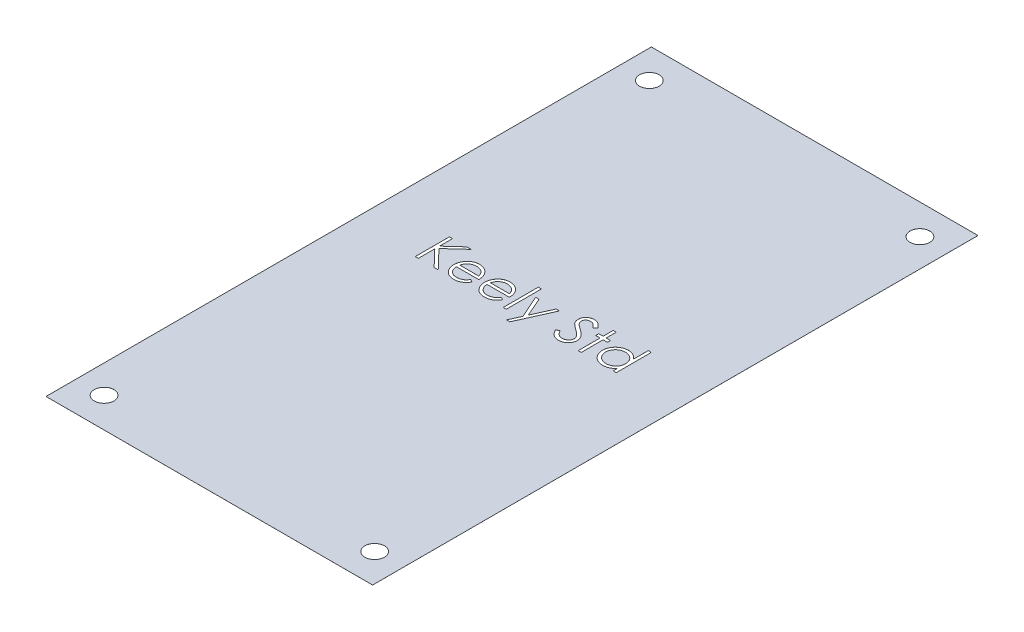
from build123d import *

# Parameters (mm, degrees)
SKETCH2_W           = 60.706
SKETCH2_H           = 112.522
BOSS_EXTRUDE1_DEPTH = 0.00254
SKETCH3_R           = 1.8288
CUT_EXTRUDE1_DEPTH  = 64.926557364
SKETCH5_W           = 0.569871795
SKETCH5_H           = 6.512820513
CUT_EXTRUDE2_DEPTH  = 2.54


with BuildPart() as part:
    # Sketch2 → Boss-Extrude1 (new body)
    with BuildSketch(Plane(origin=(0, 0, 0), x_dir=(1, 0, 0), z_dir=(0, 1, 0))):
        Rectangle(SKETCH2_W, SKETCH2_H)
    extrude(amount=BOSS_EXTRUDE1_DEPTH)

    # Sketch3 → Cut-Extrude1 (cut, through all)
    with BuildSketch(Plane(origin=(0, 0.00254, 0), x_dir=(1, 0, 0), z_dir=(0, 1, 0))):
        with Locations(Location((-25.146, 50.673, 0), (0, 0, 270))):
            Circle(SKETCH3_R)
        with Locations(Location((25.146, 50.673, 0), (0, 0, 270))):
            Circle(SKETCH3_R)
        with Locations(Location((25.146, -50.673, 0), (0, 0, 270))):
            Circle(SKETCH3_R)
        with Locations(Location((-25.146, -50.673, 0), (0, 0, 270))):
            Circle(SKETCH3_R)
    extrude(amount=-CUT_EXTRUDE1_DEPTH, mode=Mode.SUBTRACT)

    # Sketch5 → Cut-Extrude2 (cut)
    # profile 1 of 8: a face of its own
    with BuildSketch(Plane(origin=(0, 0.00254, 0), x_dir=(1, 0, 0), z_dir=(0, 1, 0))):
        Polygon((-18.557291313, 6.920253948), (-17.987419518, 6.920253948), (-17.987419518, 4.502114926), (-15.34031415, 6.920253948), (-14.527483621, 6.920253948), (-17.647786105, 4.070894974), (-14.283252852, 0.570253948), (-15.0426579, 0.570253948), (-17.987419518, 3.634586881), (-17.987419518, 0.570253948), (-18.557291313, 0.570253948), align=None)
    # profile 2 of 8: a face of its own
    with BuildSketch(Plane(origin=(0, 0.00254, 0), x_dir=(1, 0, 0), z_dir=(0, 1, 0))):
        with BuildLine():
            Line((-9.701381858, 2.035638564), (-9.195111826, 1.769783195))
            add(Edge.make_bspline(
                [(-9.195111826, 1.769783195), (-9.235455363, 1.698221722), (-9.31394791, 1.558991436), (-9.448932124, 1.367707918), (-9.590432027, 1.195627062), (-9.74483494, 1.047346118), (-9.907521358, 0.918075748), (-10.07939346, 0.804977123), (-10.261346029, 0.70860495), (-10.453387673, 0.627411078), (-10.657131144, 0.564982425), (-10.873070181, 0.520887624), (-11.101618466, 0.493631122), (-11.258275106, 0.490464938), (-11.338491233, 0.488843692)],
                knots=[0, 0, 0, 0, 1.120438281, 2.179929193, 3.190490725, 4.156257408, 5.095198341, 6.022838206, 6.959905092, 7.901321166, 8.864066838, 9.862729781, 10.905609505, 12, 12, 12, 12], degree=3))
            add(Edge.make_bspline(
                [(-11.338491233, 0.488843692), (-11.427648821, 0.490924996), (-11.601569446, 0.494985016), (-11.854734415, 0.529987059), (-12.093094217, 0.58708691), (-12.31663545, 0.666852964), (-12.52481068, 0.771042537), (-12.71803366, 0.897969026), (-12.897320514, 1.046980402), (-13.057021579, 1.219367378), (-13.200792623, 1.403847501), (-13.327658039, 1.596081748), (-13.433716522, 1.795586455), (-13.519990543, 2.001091549), (-13.589667941, 2.211301756), (-13.638230389, 2.428129704), (-13.66622436, 2.65098855), (-13.67051414, 2.801750859), (-13.672675929, 2.877725903)],
                knots=[0, 0, 0, 0, 1.145258523, 2.234067595, 3.276747158, 4.290159414, 5.277019952, 6.260822364, 7.254936242, 8.264827045, 9.274100331, 10.257902744, 11.220704747, 12.172965371, 13.118907548, 14.062713208, 15.023725156, 16, 16, 16, 16], degree=3))
            add(Edge.make_bspline(
                [(-13.672675929, 2.877725903), (-13.670754344, 2.949017953), (-13.666946016, 3.09030938), (-13.642941587, 3.299434011), (-13.600399684, 3.502685632), (-13.542022639, 3.70023313), (-13.466636807, 3.891745745), (-13.374412638, 4.077340032), (-13.265206467, 4.2568185), (-13.180891759, 4.370035614), (-13.138421121, 4.427064846)],
                knots=[0, 0, 0, 0, 1.024358464, 2.0301432, 3.019427413, 4.004406732, 4.986367066, 5.972626655, 6.978780325, 8, 8, 8, 8], degree=3))
            add(Edge.make_bspline(
                [(-13.138421121, 4.427064846), (-13.080894325, 4.495769796), (-12.967663036, 4.631003297), (-12.776153649, 4.808691402), (-12.568780435, 4.957542252), (-12.348142199, 5.080926627), (-12.111674596, 5.174677387), (-11.862556311, 5.244541143), (-11.597950748, 5.28368982), (-11.41705699, 5.289219461), (-11.324498845, 5.29204882)],
                knots=[0, 0, 0, 0, 1.030682036, 2.02871468, 2.997146059, 3.962720338, 4.930598197, 5.918074684, 6.934738563, 8, 8, 8, 8], degree=3))
            add(Edge.make_bspline(
                [(-11.324498845, 5.29204882), (-11.229343904, 5.289592188), (-11.042671601, 5.284772837), (-10.770470467, 5.240093632), (-10.512913167, 5.169241141), (-10.270102766, 5.069176406), (-10.042014647, 4.940072648), (-9.830131386, 4.780158164), (-9.630829356, 4.594342492), (-9.514880935, 4.451443526), (-9.455879054, 4.378727506)],
                knots=[0, 0, 0, 0, 1.056321875, 2.072262726, 3.055038591, 4.01806755, 4.982017516, 5.957941055, 6.960871419, 8, 8, 8, 8], degree=3))
            add(Edge.make_bspline(
                [(-9.455879054, 4.378727506), (-9.415734465, 4.32392958), (-9.335712504, 4.214698479), (-9.235478479, 4.036587951), (-9.148470063, 3.850241587), (-9.078923119, 3.652647191), (-9.022608596, 3.446145952), (-8.98186551, 3.229261621), (-8.957972059, 3.002058782), (-8.953275423, 2.847252031), (-8.950881057, 2.768330871)],
                knots=[0, 0, 0, 0, 0.94817472, 1.890038105, 2.849395472, 3.817997239, 4.812318967, 5.836947057, 6.897266129, 8, 8, 8, 8], degree=3))
            Line((-8.950881057, 2.768330871), (-13.102804134, 2.768330871))
            add(Edge.make_bspline(
                [(-13.102804134, 2.768330871), (-13.100010848, 2.7071886), (-13.094517964, 2.586954791), (-13.068909061, 2.411022084), (-13.028543429, 2.243430449), (-12.971812415, 2.08543693), (-12.903111138, 1.934977985), (-12.818954195, 1.793169717), (-12.718552433, 1.660658044), (-12.606564378, 1.536257666), (-12.481910077, 1.425476), (-12.350768521, 1.326322063), (-12.211261625, 1.243217623), (-12.064489388, 1.17576268), (-11.910689149, 1.122955507), (-11.749812452, 1.086909603), (-11.582175869, 1.062766709), (-11.467901752, 1.060082174), (-11.409725207, 1.058715487)],
                knots=[0, 0, 0, 0, 1.094153842, 2.151609401, 3.174256925, 4.172055639, 5.149267565, 6.128595816, 7.11444997, 8.118368179, 9.117203808, 10.09244225, 11.054858984, 12.015122123, 12.976791628, 13.957293641, 14.960065497, 16, 16, 16, 16], degree=3))
            add(Edge.make_bspline(
                [(-11.409725207, 1.058715487), (-11.352845268, 1.059818675), (-11.239984557, 1.062007613), (-11.071907573, 1.083292651), (-10.906554431, 1.117710151), (-10.744609504, 1.16468199), (-10.589359541, 1.221971422), (-10.445585471, 1.291100892), (-10.313359937, 1.367572576), (-10.189776298, 1.4550387), (-10.069904639, 1.562096411), (-9.950991842, 1.695692648), (-9.823489914, 1.853694305), (-9.743680224, 1.972612871), (-9.701381858, 2.035638564)],
                knots=[0, 0, 0, 0, 0.99110716, 1.966546729, 2.947904876, 3.932708344, 4.903319531, 5.828989031, 6.710028674, 7.56322171, 8.463672341, 9.504779593, 10.677557249, 12, 12, 12, 12], degree=3))
        make_face()
        with BuildLine():
            add(Edge.make_bspline(
                [(-9.520752852, 3.338202666), (-9.541611013, 3.413791023), (-9.58175626, 3.559274277), (-9.665642236, 3.760734178), (-9.760114888, 3.939782227), (-9.871914315, 4.095048133), (-9.998585432, 4.232940221), (-10.144898834, 4.353442511), (-10.308975384, 4.461242744), (-10.489966968, 4.552233707), (-10.681631349, 4.629685308), (-10.882302583, 4.681619447), (-11.087058856, 4.717196759), (-11.225551061, 4.720509841), (-11.295242034, 4.722177025)],
                knots=[0, 0, 0, 0, 1.154881502, 2.222775134, 3.210006277, 4.132804581, 5.035138423, 5.962687519, 6.919655026, 7.923214229, 8.944639381, 9.960483929, 10.97369054, 12, 12, 12, 12], degree=3))
            add(Edge.make_bspline(
                [(-11.295242034, 4.722177025), (-11.352118873, 4.721067278), (-11.464552425, 4.718873542), (-11.630198648, 4.69806345), (-11.789274673, 4.663664874), (-11.942954267, 4.616557024), (-12.089223556, 4.553767131), (-12.231091207, 4.480137563), (-12.364949926, 4.390254975), (-12.44866342, 4.321749624), (-12.490955175, 4.287140967)],
                knots=[0, 0, 0, 0, 1.04873581, 2.073130211, 3.073294108, 4.04793562, 5.032784715, 6.005352987, 6.992311501, 8, 8, 8, 8], degree=3))
            add(Edge.make_bspline(
                [(-12.490955175, 4.287140967), (-12.521241558, 4.259755566), (-12.582533816, 4.204334188), (-12.664431619, 4.108849771), (-12.742845906, 4.005886222), (-12.81420839, 3.891504353), (-12.87966344, 3.767006654), (-12.940913684, 3.63344323), (-12.996043317, 3.489800551), (-13.027060545, 3.389701983), (-13.043018477, 3.338202666)],
                knots=[0, 0, 0, 0, 0.879870761, 1.780643979, 2.707998968, 3.669668524, 4.684282772, 5.740141944, 6.837334558, 8, 8, 8, 8], degree=3))
            Line((-13.043018477, 3.338202666), (-9.520752852, 3.338202666))
        make_face(mode=Mode.SUBTRACT)
    # profile 3 of 8: a face of its own
    with BuildSketch(Plane(origin=(0, 0.00254, 0), x_dir=(1, 0, 0), z_dir=(0, 1, 0))):
        with BuildLine():
            Line((-4.002663909, 2.035638564), (-3.496393877, 1.769783195))
            add(Edge.make_bspline(
                [(-3.496393877, 1.769783195), (-3.536737414, 1.698221722), (-3.615229961, 1.558991436), (-3.750214175, 1.367707918), (-3.891714078, 1.195627062), (-4.046116992, 1.047346118), (-4.208803409, 0.918075748), (-4.380675511, 0.804977123), (-4.562628081, 0.70860495), (-4.754669724, 0.627411078), (-4.958413196, 0.564982425), (-5.174352233, 0.520887624), (-5.402900517, 0.493631122), (-5.559557158, 0.490464938), (-5.639773284, 0.488843692)],
                knots=[0, 0, 0, 0, 1.120438281, 2.179929193, 3.190490725, 4.156257408, 5.095198341, 6.022838206, 6.959905092, 7.901321166, 8.864066838, 9.862729781, 10.905609505, 12, 12, 12, 12], degree=3))
            add(Edge.make_bspline(
                [(-5.639773284, 0.488843692), (-5.728930872, 0.490924996), (-5.902851497, 0.494985016), (-6.156016467, 0.529987059), (-6.394376269, 0.58708691), (-6.617917502, 0.666852964), (-6.826092731, 0.771042537), (-7.019315711, 0.897969026), (-7.198602565, 1.046980402), (-7.35830363, 1.219367378), (-7.502074675, 1.403847501), (-7.628940091, 1.596081748), (-7.734998573, 1.795586455), (-7.821272594, 2.001091549), (-7.890949992, 2.211301756), (-7.93951244, 2.428129704), (-7.967506412, 2.65098855), (-7.971796191, 2.801750859), (-7.97395798, 2.877725903)],
                knots=[0, 0, 0, 0, 1.145258523, 2.234067595, 3.276747158, 4.290159414, 5.277019952, 6.260822364, 7.254936242, 8.264827045, 9.274100331, 10.257902744, 11.220704747, 12.172965371, 13.118907548, 14.062713208, 15.023725156, 16, 16, 16, 16], degree=3))
            add(Edge.make_bspline(
                [(-7.97395798, 2.877725903), (-7.972036395, 2.949017953), (-7.968228067, 3.09030938), (-7.944223639, 3.299434011), (-7.901681735, 3.502685632), (-7.843304691, 3.70023313), (-7.767918858, 3.891745745), (-7.675694689, 4.077340032), (-7.566488518, 4.2568185), (-7.48217381, 4.370035614), (-7.439703172, 4.427064846)],
                knots=[0, 0, 0, 0, 1.024358464, 2.0301432, 3.019427413, 4.004406732, 4.986367066, 5.972626655, 6.978780325, 8, 8, 8, 8], degree=3))
            add(Edge.make_bspline(
                [(-7.439703172, 4.427064846), (-7.382176376, 4.495769796), (-7.268945087, 4.631003297), (-7.0774357, 4.808691402), (-6.870062486, 4.957542252), (-6.649424251, 5.080926627), (-6.412956648, 5.174677387), (-6.163838362, 5.244541143), (-5.899232799, 5.28368982), (-5.718339041, 5.289219461), (-5.625780896, 5.29204882)],
                knots=[0, 0, 0, 0, 1.030682036, 2.02871468, 2.997146059, 3.962720338, 4.930598197, 5.918074684, 6.934738563, 8, 8, 8, 8], degree=3))
            add(Edge.make_bspline(
                [(-5.625780896, 5.29204882), (-5.530625955, 5.289592188), (-5.343953652, 5.284772837), (-5.071752518, 5.240093632), (-4.814195218, 5.169241141), (-4.571384818, 5.069176406), (-4.343296699, 4.940072648), (-4.131413437, 4.780158164), (-3.932111407, 4.594342492), (-3.816162986, 4.451443526), (-3.757161105, 4.378727506)],
                knots=[0, 0, 0, 0, 1.056321875, 2.072262726, 3.055038591, 4.01806755, 4.982017516, 5.957941055, 6.960871419, 8, 8, 8, 8], degree=3))
            add(Edge.make_bspline(
                [(-3.757161105, 4.378727506), (-3.717016517, 4.32392958), (-3.636994555, 4.214698479), (-3.536760531, 4.036587951), (-3.449752114, 3.850241587), (-3.38020517, 3.652647191), (-3.323890647, 3.446145952), (-3.283147561, 3.229261621), (-3.259254111, 3.002058782), (-3.254557474, 2.847252031), (-3.252163108, 2.768330871)],
                knots=[0, 0, 0, 0, 0.94817472, 1.890038105, 2.849395472, 3.817997239, 4.812318967, 5.836947057, 6.897266129, 8, 8, 8, 8], degree=3))
            Line((-3.252163108, 2.768330871), (-7.404086185, 2.768330871))
            add(Edge.make_bspline(
                [(-7.404086185, 2.768330871), (-7.401292899, 2.7071886), (-7.395800015, 2.586954791), (-7.370191112, 2.411022084), (-7.32982548, 2.243430449), (-7.273094466, 2.08543693), (-7.20439319, 1.934977985), (-7.120236246, 1.793169717), (-7.019834484, 1.660658044), (-6.90784643, 1.536257666), (-6.783192128, 1.425476), (-6.652050572, 1.326322063), (-6.512543676, 1.243217623), (-6.365771439, 1.17576268), (-6.2119712, 1.122955507), (-6.051094503, 1.086909603), (-5.883457921, 1.062766709), (-5.769183803, 1.060082174), (-5.711007259, 1.058715487)],
                knots=[0, 0, 0, 0, 1.094153842, 2.151609401, 3.174256925, 4.172055639, 5.149267565, 6.128595816, 7.11444997, 8.118368179, 9.117203808, 10.09244225, 11.054858984, 12.015122123, 12.976791628, 13.957293641, 14.960065497, 16, 16, 16, 16], degree=3))
            add(Edge.make_bspline(
                [(-5.711007259, 1.058715487), (-5.654127319, 1.059818675), (-5.541266609, 1.062007613), (-5.373189625, 1.083292651), (-5.207836482, 1.117710151), (-5.045891555, 1.16468199), (-4.890641592, 1.221971422), (-4.746867523, 1.291100892), (-4.614641989, 1.367572576), (-4.491058349, 1.4550387), (-4.37118669, 1.562096411), (-4.252273893, 1.695692648), (-4.124771965, 1.853694305), (-4.044962275, 1.972612871), (-4.002663909, 2.035638564)],
                knots=[0, 0, 0, 0, 0.99110716, 1.966546729, 2.947904876, 3.932708344, 4.903319531, 5.828989031, 6.710028674, 7.56322171, 8.463672341, 9.504779593, 10.677557249, 12, 12, 12, 12], degree=3))
        make_face()
        with BuildLine():
            add(Edge.make_bspline(
                [(-3.822034903, 3.338202666), (-3.842893065, 3.413791023), (-3.883038312, 3.559274277), (-3.966924287, 3.760734178), (-4.061396939, 3.939782227), (-4.173196366, 4.095048133), (-4.299867483, 4.232940221), (-4.446180886, 4.353442511), (-4.610257435, 4.461242744), (-4.791249019, 4.552233707), (-4.982913401, 4.629685308), (-5.183584635, 4.681619447), (-5.388340907, 4.717196759), (-5.526833112, 4.720509841), (-5.596524086, 4.722177025)],
                knots=[0, 0, 0, 0, 1.154881502, 2.222775134, 3.210006277, 4.132804581, 5.035138423, 5.962687519, 6.919655026, 7.923214229, 8.944639381, 9.960483929, 10.97369054, 12, 12, 12, 12], degree=3))
            add(Edge.make_bspline(
                [(-5.596524086, 4.722177025), (-5.653400924, 4.721067278), (-5.765834476, 4.718873542), (-5.9314807, 4.69806345), (-6.090556725, 4.663664874), (-6.244236318, 4.616557024), (-6.390505608, 4.553767131), (-6.532373259, 4.480137563), (-6.666231978, 4.390254975), (-6.749945471, 4.321749624), (-6.792237227, 4.287140967)],
                knots=[0, 0, 0, 0, 1.04873581, 2.073130211, 3.073294108, 4.04793562, 5.032784715, 6.005352987, 6.992311501, 8, 8, 8, 8], degree=3))
            add(Edge.make_bspline(
                [(-6.792237227, 4.287140967), (-6.82252361, 4.259755566), (-6.883815867, 4.204334188), (-6.965713671, 4.108849771), (-7.044127957, 4.005886222), (-7.115490441, 3.891504353), (-7.180945491, 3.767006654), (-7.242195735, 3.63344323), (-7.297325368, 3.489800551), (-7.328342597, 3.389701983), (-7.344300528, 3.338202666)],
                knots=[0, 0, 0, 0, 0.879870761, 1.780643979, 2.707998968, 3.669668524, 4.684282772, 5.740141944, 6.837334558, 8, 8, 8, 8], degree=3))
            Line((-7.344300528, 3.338202666), (-3.822034903, 3.338202666))
        make_face(mode=Mode.SUBTRACT)
    # profile 4 of 8: a face of its own
    with BuildSketch(Plane(origin=(0, 0.00254, 0), x_dir=(1, 0, 0), z_dir=(0, 1, 0))):
        with Locations((-1.908893878, 3.826664205)):
            Rectangle(SKETCH5_W, SKETCH5_H)
    # profile 5 of 8: a face of its own
    with BuildSketch(Plane(origin=(0, 0.00254, 0), x_dir=(1, 0, 0), z_dir=(0, 1, 0))):
        Polygon((-0.809855416, 5.210638564), (-0.195462387, 5.210638564), (1.375501155, 1.656572057), (2.970633366, 5.210638564), (3.58629843, 5.210638564), (0.736939456, -1.139361436), (0.121274392, -1.139361436), (1.066396588, 0.965856913), align=None)
    # profile 6 of 8: a face of its own
    with BuildSketch(Plane(origin=(0, 0.00254, 0), x_dir=(1, 0, 0), z_dir=(0, 1, 0))):
        with BuildLine():
            Line((6.272836892, 1.7952239), (6.80963577, 2.11704882))
            add(Edge.make_bspline(
                [(6.80963577, 2.11704882), (6.859561715, 2.033474864), (6.955217898, 1.873350391), (7.114786793, 1.656982232), (7.280127932, 1.473082319), (7.452465723, 1.322720474), (7.630748228, 1.20434035), (7.816139297, 1.120516302), (8.008014182, 1.068235889), (8.138595259, 1.061885732), (8.203786411, 1.058715487)],
                knots=[0, 0, 0, 0, 1.272034388, 2.437168799, 3.508375237, 4.49857839, 5.41946034, 6.295179144, 7.148887113, 8, 8, 8, 8], degree=3))
            add(Edge.make_bspline(
                [(8.203786411, 1.058715487), (8.259461144, 1.060266107), (8.369836432, 1.063340215), (8.53232793, 1.092878241), (8.690137771, 1.13825739), (8.840013443, 1.203246794), (8.979886915, 1.281875189), (9.102544776, 1.376846111), (9.208582724, 1.483174513), (9.295322118, 1.601797329), (9.361870182, 1.729372728), (9.413018649, 1.860320525), (9.441403283, 1.996697785), (9.445679107, 2.088519624), (9.447836892, 2.134857314)],
                knots=[0, 0, 0, 0, 1.095163259, 2.171163733, 3.241058638, 4.321873601, 5.38011039, 6.391990106, 7.366004449, 8.327778327, 9.272591725, 10.192022065, 11.087607919, 12, 12, 12, 12], degree=3))
            add(Edge.make_bspline(
                [(9.447836892, 2.134857314), (9.445162071, 2.187727141), (9.439724551, 2.295203774), (9.393766009, 2.453771716), (9.32146809, 2.61069395), (9.25477015, 2.707760532), (9.220142581, 2.758154589)],
                knots=[0, 0, 0, 0, 0.938893495, 1.908633276, 2.914225137, 4, 4, 4, 4], degree=3))
            add(Edge.make_bspline(
                [(9.220142581, 2.758154589), (9.19171161, 2.794525255), (9.132024341, 2.870880918), (9.029412854, 2.984537274), (8.909005761, 3.101773548), (8.774923597, 3.227066409), (8.622282136, 3.354588554), (8.455862217, 3.490421001), (8.27141493, 3.629398148), (8.142057272, 3.72260266), (8.07531085, 3.770694653)],
                knots=[0, 0, 0, 0, 0.722233717, 1.516239348, 2.393582979, 3.351407094, 4.387010283, 5.505090956, 6.712668013, 8, 8, 8, 8], degree=3))
            add(Edge.make_bspline(
                [(8.07531085, 3.770694653), (8.0085016, 3.818280805), (7.880767401, 3.909261904), (7.702135402, 4.044288819), (7.54239759, 4.167739839), (7.402263946, 4.280777119), (7.281796106, 4.383415987), (7.180044775, 4.47467082), (7.099601964, 4.557009566), (7.054869696, 4.610424571), (7.034786011, 4.634406592)],
                knots=[0, 0, 0, 0, 1.452282411, 2.77665338, 3.964542531, 5.026858415, 5.96415736, 6.766646006, 7.446254459, 8, 8, 8, 8], degree=3))
            add(Edge.make_bspline(
                [(7.034786011, 4.634406592), (7.006714393, 4.671782759), (6.951507789, 4.745288008), (6.878635179, 4.860177392), (6.816696984, 4.977785317), (6.768142467, 5.098427814), (6.727255327, 5.220411185), (6.69975451, 5.345327016), (6.682534404, 5.472614796), (6.680770943, 5.558273575), (6.679888174, 5.601153387)],
                knots=[0, 0, 0, 0, 1.068054152, 2.10047183, 3.106115577, 4.101338837, 5.06977816, 6.043150881, 7.020423561, 8, 8, 8, 8], degree=3))
            add(Edge.make_bspline(
                [(6.679888174, 5.601153387), (6.682256196, 5.668335978), (6.686941625, 5.80126518), (6.726566564, 5.995449686), (6.789110242, 6.180845043), (6.876730967, 6.355615792), (6.989683593, 6.515211214), (7.120395575, 6.661467112), (7.276082129, 6.784418682), (7.446901888, 6.891846274), (7.633875592, 6.975931024), (7.829801945, 7.039360231), (8.034992347, 7.075299884), (8.17397232, 7.080457472), (8.244491539, 7.083074461)],
                knots=[0, 0, 0, 0, 1.005424448, 1.989358655, 2.955360095, 3.929531133, 4.905563448, 5.876582895, 6.856512386, 7.866279853, 8.892233794, 9.918561126, 10.94386622, 12, 12, 12, 12], degree=3))
            add(Edge.make_bspline(
                [(8.244491539, 7.083074461), (8.319320121, 7.080493546), (8.468130288, 7.07536093), (8.687022436, 7.03073398), (8.897771165, 6.956891333), (9.067303945, 6.87309191), (9.19998767, 6.789396342), (9.301175342, 6.713160375), (9.403714145, 6.625394106), (9.508431188, 6.52586376), (9.613552098, 6.413656083), (9.720637505, 6.289539547), (9.829937821, 6.154272653), (9.900252024, 6.057708202), (9.93629843, 6.008204669)],
                knots=[0, 0, 0, 0, 1.286793592, 2.559021753, 3.825965368, 5.121522368, 5.803751409, 6.523245864, 7.299691795, 8.125521123, 9.008227632, 9.944561021, 10.946284179, 12, 12, 12, 12], degree=3))
            Line((9.93629843, 6.008204669), (9.421124152, 5.617689846))
            add(Edge.make_bspline(
                [(9.421124152, 5.617689846), (9.390016531, 5.657765041), (9.330110528, 5.734940498), (9.239161316, 5.843019885), (9.153438769, 5.941746926), (9.068983044, 6.027499373), (8.990254598, 6.104973243), (8.91384225, 6.171303088), (8.840845641, 6.227138811), (8.748830675, 6.286726412), (8.633228529, 6.345793212), (8.488113727, 6.39577511), (8.336464342, 6.425810723), (8.233177725, 6.42978199), (8.180889777, 6.43179241)],
                knots=[0, 0, 0, 0, 1.181633172, 2.275549214, 3.290209073, 4.226197932, 5.078386478, 5.862611352, 6.581680152, 7.217281963, 8.414376989, 9.595101626, 10.782541182, 12, 12, 12, 12], degree=3))
            add(Edge.make_bspline(
                [(8.180889777, 6.43179241), (8.115291515, 6.42959404), (7.988791446, 6.42535469), (7.809194874, 6.379054146), (7.647553039, 6.306152771), (7.508664814, 6.20398131), (7.393027727, 6.082930366), (7.309379252, 5.943631587), (7.259032525, 5.789812085), (7.252888846, 5.682512222), (7.249759969, 5.627866128)],
                knots=[0, 0, 0, 0, 1.14458467, 2.207223713, 3.21896685, 4.227309161, 5.202851033, 6.127160689, 7.046193047, 8, 8, 8, 8], degree=3))
            add(Edge.make_bspline(
                [(7.249759969, 5.627866128), (7.250473213, 5.593845588), (7.251900867, 5.525748878), (7.271812286, 5.425144156), (7.297392497, 5.324793583), (7.337928415, 5.225148325), (7.393890608, 5.124465703), (7.46737857, 5.021011979), (7.559931294, 4.913875307), (7.630828159, 4.844193358), (7.668259568, 4.807403387)],
                knots=[0, 0, 0, 0, 0.858281714, 1.717966888, 2.583508476, 3.4729293, 4.427298488, 5.488583878, 6.674047936, 8, 8, 8, 8], degree=3))
            add(Edge.make_bspline(
                [(7.668259568, 4.807403387), (7.682159487, 4.794999069), (7.715182511, 4.765529248), (7.775554548, 4.717283253), (7.855279339, 4.657769652), (7.952275047, 4.584132664), (8.068330118, 4.49871344), (8.203457312, 4.402604172), (8.356150379, 4.292684839), (8.464502998, 4.215836158), (8.521795225, 4.175201865)],
                knots=[0, 0, 0, 0, 0.420754252, 0.999615792, 1.744751191, 2.668019286, 3.750313428, 4.999500688, 6.413464383, 8, 8, 8, 8], degree=3))
            add(Edge.make_bspline(
                [(8.521795225, 4.175201865), (8.590712525, 4.125052541), (8.724161325, 4.027945326), (8.914040077, 3.882048307), (9.086204557, 3.739358784), (9.241259226, 3.600787982), (9.380735903, 3.467387014), (9.503087196, 3.337550958), (9.609559788, 3.21220999), (9.724184941, 3.051514031), (9.841311271, 2.854154064), (9.941898006, 2.61234926), (10.005322436, 2.369604507), (10.013616472, 2.206451532), (10.017708687, 2.125953067)],
                knots=[0, 0, 0, 0, 1.163667725, 2.253281268, 3.268753668, 4.215851969, 5.092017293, 5.902905408, 6.650798638, 7.335211899, 8.59617414, 9.77448103, 10.901945474, 12, 12, 12, 12], degree=3))
            add(Edge.make_bspline(
                [(10.017708687, 2.125953067), (10.016516451, 2.069023747), (10.01415513, 1.956270637), (9.987011758, 1.790707855), (9.947243223, 1.629906134), (9.887304241, 1.475853116), (9.814146511, 1.325730475), (9.721316319, 1.183476141), (9.613715234, 1.045941675), (9.490282546, 0.916794484), (9.355216409, 0.798237814), (9.212461706, 0.692775088), (9.061784782, 0.604839701), (8.904003036, 0.533083174), (8.739080225, 0.476960935), (8.567071817, 0.436297586), (8.387694275, 0.411340797), (8.265773402, 0.408750429), (8.203786411, 0.407433435)],
                knots=[0, 0, 0, 0, 0.983748083, 1.948392443, 2.894712957, 3.844097841, 4.80183111, 5.778335162, 6.776009319, 7.81870978, 8.863265674, 9.881300176, 10.883814829, 11.87499822, 12.874611388, 13.892143829, 14.928324115, 16, 16, 16, 16], degree=3))
            add(Edge.make_bspline(
                [(8.203786411, 0.407433435), (8.155825146, 0.408360865), (8.060506639, 0.410204044), (7.919519436, 0.426498652), (7.781380467, 0.449552969), (7.647823127, 0.486154496), (7.51712668, 0.530562726), (7.389859554, 0.585242272), (7.265960071, 0.650769195), (7.144733885, 0.725690168), (7.026489311, 0.812880647), (6.912335419, 0.914432562), (6.798526754, 1.027545121), (6.688422478, 1.155290001), (6.579795487, 1.295603379), (6.474787516, 1.449798041), (6.371224971, 1.617034097), (6.306245479, 1.734717895), (6.272836892, 1.7952239)],
                knots=[0, 0, 0, 0, 0.915332311, 1.819136955, 2.706846663, 3.586547465, 4.459518054, 5.340707479, 6.227863349, 7.133153174, 8.059268498, 9.028702269, 10.047606654, 11.120612155, 12.245963614, 13.433783089, 14.680604001, 16, 16, 16, 16], degree=3))
        make_face()
    # profile 7 of 8: a face of its own
    with BuildSketch(Plane(origin=(0, 0.00254, 0), x_dir=(1, 0, 0), z_dir=(0, 1, 0))):
        Polygon((11.727324071, 7.083074461), (12.297195866, 7.083074461), (12.297195866, 5.210638564), (13.11129843, 5.210638564), (13.11129843, 4.640766769), (12.297195866, 4.640766769), (12.297195866, 0.570253948), (11.727324071, 0.570253948), (11.727324071, 4.640766769), (10.913221507, 4.640766769), (10.913221507, 5.210638564), (11.727324071, 5.210638564), align=None)
    # profile 8 of 8: a face of its own
    with BuildSketch(Plane(origin=(0, 0.00254, 0), x_dir=(1, 0, 0), z_dir=(0, 1, 0))):
        with BuildLine():
            Line((18.810016379, 7.083074461), (18.810016379, 0.570253948))
            Line((18.810016379, 0.570253948), (18.240144584, 0.570253948))
            Line((18.240144584, 0.570253948), (18.240144584, 1.372908195))
            add(Edge.make_bspline(
                [(18.240144584, 1.372908195), (18.175884778, 1.300264932), (18.050480959, 1.15850069), (17.841037788, 0.973294463), (17.619026951, 0.820208079), (17.385525983, 0.696564661), (17.140745741, 0.603687644), (16.88522884, 0.537672756), (16.618871049, 0.495229655), (16.436984634, 0.490991443), (16.344812052, 0.488843692)],
                knots=[0, 0, 0, 0, 1.074387032, 2.096679803, 3.090159297, 4.057316773, 5.018401886, 5.985159533, 6.978961417, 8, 8, 8, 8], degree=3))
            add(Edge.make_bspline(
                [(16.344812052, 0.488843692), (16.262864479, 0.491068681), (16.101260236, 0.49545646), (15.863536053, 0.529496639), (15.634768686, 0.584162195), (15.414741961, 0.660182381), (15.20487964, 0.761021871), (15.003384894, 0.881746707), (14.811301581, 1.025512213), (14.631557503, 1.189864779), (14.466036588, 1.368381398), (14.320782565, 1.558782605), (14.199673406, 1.760245071), (14.098399831, 1.970218078), (14.020392177, 2.190318004), (13.966011441, 2.419783723), (13.932010916, 2.658343922), (13.927624952, 2.820794199), (13.925400995, 2.903166608)],
                knots=[0, 0, 0, 0, 1.033919861, 2.038935746, 3.024066025, 3.998881131, 4.97069526, 5.957263378, 6.95902576, 7.993208707, 9.027059324, 10.027763471, 11.009749337, 11.988697705, 12.965288445, 13.950418724, 14.960734635, 16, 16, 16, 16], degree=3))
            add(Edge.make_bspline(
                [(13.925400995, 2.903166608), (13.927674243, 2.983836471), (13.932168331, 3.143316436), (13.965647745, 3.377864931), (14.02194686, 3.603776633), (14.100955098, 3.82032423), (14.202268359, 4.027769749), (14.325509317, 4.226259909), (14.470686872, 4.41634153), (14.638059096, 4.593545042), (14.819369322, 4.757231013), (15.013332305, 4.899487424), (15.215123116, 5.022345136), (15.427871721, 5.119687871), (15.648429182, 5.19844439), (15.878759005, 5.252932775), (16.117902869, 5.285040772), (16.280264191, 5.289690358), (16.362620546, 5.29204882)],
                knots=[0, 0, 0, 0, 1.020392517, 2.01726096, 2.990465484, 3.961182959, 4.928053699, 5.906110375, 6.912531644, 7.948652711, 8.985773172, 9.998621852, 10.987621588, 11.969261332, 12.953316658, 13.946091881, 14.958173133, 16, 16, 16, 16], degree=3))
            add(Edge.make_bspline(
                [(16.362620546, 5.29204882), (16.457356754, 5.28920566), (16.643313403, 5.283624853), (16.915272149, 5.236986159), (17.172515385, 5.158676366), (17.416524091, 5.051467898), (17.645843565, 4.912129393), (17.862154756, 4.743851766), (18.061695927, 4.541872515), (18.179754805, 4.390177232), (18.240144584, 4.312581673)],
                knots=[0, 0, 0, 0, 1.031072012, 2.023879775, 2.993683497, 3.952812103, 4.918022106, 5.908088563, 6.929940113, 8, 8, 8, 8], degree=3))
            Line((18.240144584, 4.312581673), (18.240144584, 7.083074461))
            Line((18.240144584, 7.083074461), (18.810016379, 7.083074461))
        make_face()
        with BuildLine():
            add(Edge.make_bspline(
                [(16.370252757, 4.722177025), (16.28695103, 4.719213139), (16.12252667, 4.713362901), (15.881146838, 4.667690988), (15.650163929, 4.591700367), (15.430733195, 4.487774632), (15.226320859, 4.357093924), (15.04363377, 4.199030843), (14.881177726, 4.017897974), (14.744547018, 3.814512717), (14.633167117, 3.596475323), (14.554849788, 3.3685567), (14.503198439, 3.134867669), (14.497921551, 2.976366796), (14.495272789, 2.896806432)],
                knots=[0, 0, 0, 0, 1.031046209, 2.035121221, 3.029706178, 4.034933723, 5.034054252, 6.02443088, 7.017295772, 8.038157696, 9.050218397, 10.03989886, 11.016116709, 12, 12, 12, 12], degree=3))
            add(Edge.make_bspline(
                [(14.495272789, 2.896806432), (14.498656239, 2.817721523), (14.505409875, 2.659861692), (14.553943278, 2.425854074), (14.635368191, 2.197881741), (14.746478791, 1.977879652), (14.885610238, 1.773619928), (15.046879651, 1.589034277), (15.23184659, 1.430303166), (15.436729353, 1.297429283), (15.65554667, 1.190091566), (15.88565966, 1.115405335), (16.122742604, 1.067185647), (16.283946124, 1.061553239), (16.365164616, 1.058715487)],
                knots=[0, 0, 0, 0, 0.979072187, 1.954306742, 2.945804271, 3.96968567, 4.997920485, 5.998718438, 6.996577872, 8.005894225, 9.015743152, 10.005417472, 10.995077863, 12, 12, 12, 12], degree=3))
            add(Edge.make_bspline(
                [(16.365164616, 1.058715487), (16.447617557, 1.061727135), (16.611608278, 1.067717006), (16.85370422, 1.113584445), (17.088645081, 1.189364979), (17.313230481, 1.294410537), (17.52244689, 1.424598883), (17.710221611, 1.577011748), (17.869000582, 1.754273239), (18.003607174, 1.949084804), (18.109154001, 2.162647998), (18.18603628, 2.39004003), (18.231491224, 2.631268816), (18.237220247, 2.79612194), (18.240144584, 2.880269974)],
                knots=[0, 0, 0, 0, 1.01762866, 2.023962475, 3.030623092, 4.058876274, 5.077231937, 6.066672613, 7.034107872, 8.005628644, 8.981990164, 9.965428785, 10.961468474, 12, 12, 12, 12], degree=3))
            add(Edge.make_bspline(
                [(18.240144584, 2.880269974), (18.238403493, 2.944382895), (18.234976476, 3.070577413), (18.2087953, 3.255865909), (18.167148504, 3.433182812), (18.10846331, 3.602714547), (18.03137198, 3.76352379), (17.93839389, 3.916765183), (17.827894003, 4.061641724), (17.701651112, 4.196158438), (17.563465673, 4.318852163), (17.417244149, 4.428370142), (17.261254137, 4.518338344), (17.098118941, 4.592798937), (16.92755552, 4.652051966), (16.748175967, 4.691581068), (16.561886948, 4.718723364), (16.43480339, 4.721013684), (16.370252757, 4.722177025)],
                knots=[0, 0, 0, 0, 1.050140795, 2.067009409, 3.05949893, 4.030605086, 5.00011959, 5.97591094, 6.962425594, 7.979863591, 8.993523472, 9.986985069, 10.967611495, 11.937549037, 12.921786183, 13.919465291, 14.943216303, 16, 16, 16, 16], degree=3))
        make_face(mode=Mode.SUBTRACT)
    extrude(amount=-CUT_EXTRUDE2_DEPTH, mode=Mode.SUBTRACT)


with BuildPart() as cut_extrude2_piece_1:
    # of the separate pieces the step leaves, piece 1, a body of its own (cut_extrude2_pieces)
    add(part.part.solids().sort_by_distance((-30.353, 0, 56.261))[0])


with BuildPart() as cut_extrude2_piece_2:
    # of the separate pieces the step leaves, piece 2, a body of its own (cut_extrude2_pieces)
    add(part.part.solids().sort_by_distance((14.495272789, 0, -2.896806432))[0])


with BuildPart() as cut_extrude2_piece_3:
    # of the separate pieces the step leaves, piece 3, a body of its own (cut_extrude2_pieces)
    add(part.part.solids().sort_by_distance((-5.596524086, 0, -4.722177025))[0])


with BuildPart() as cut_extrude2_piece_4:
    # of the separate pieces the step leaves, piece 4, a body of its own (cut_extrude2_pieces)
    add(part.part.solids().sort_by_distance((-11.295242034, 0, -4.722177025))[0])


solid = Compound([cut_extrude2_piece_1.part, cut_extrude2_piece_2.part, cut_extrude2_piece_3.part, cut_extrude2_piece_4.part])
